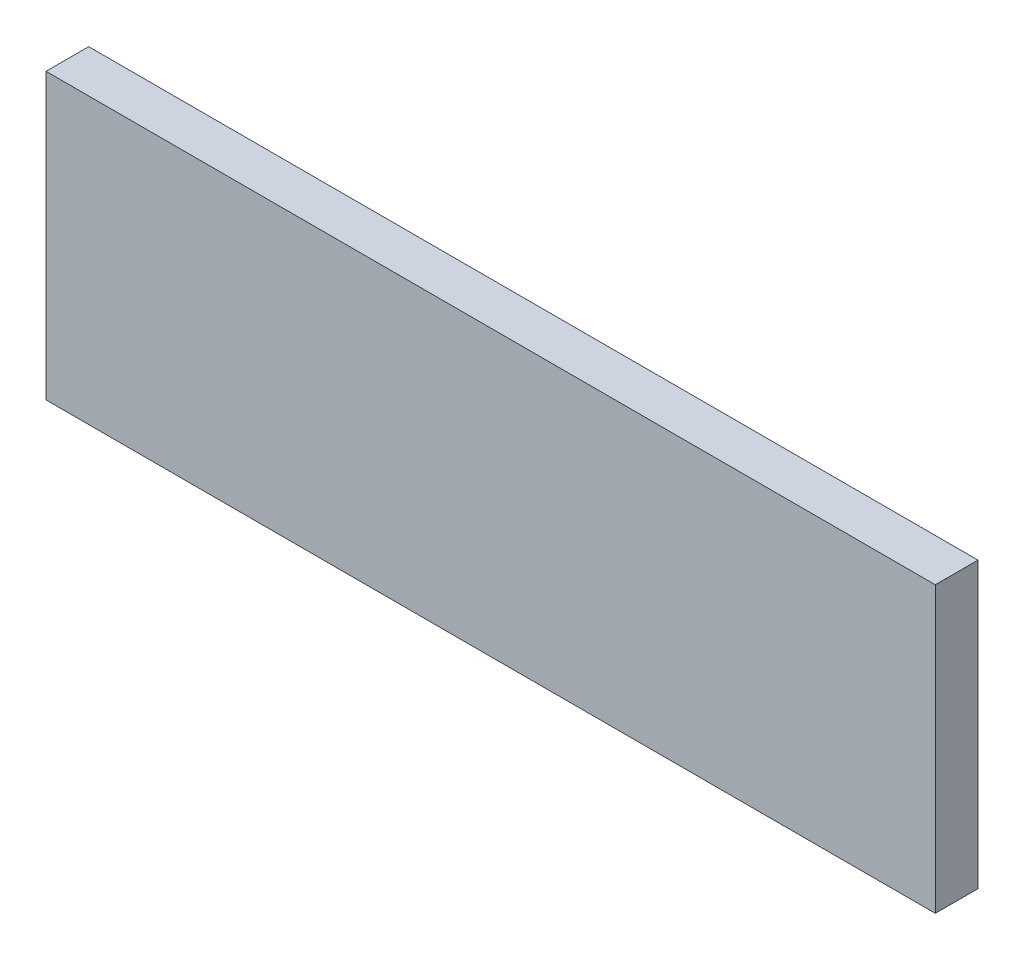
from build123d import *

# Parameters (mm, degrees)
CROQUIS1_W              = 25
CROQUIS1_H              = 8
SALIENTE_EXTRUIR1_DEPTH = 1.2


with BuildPart() as part:
    # Croquis1 → Saliente-Extruir1 (new body)
    with BuildSketch(Plane.XY):
        with Locations((-11.184210526, 1.951417004)):
            Rectangle(CROQUIS1_W, CROQUIS1_H)
    extrude(amount=SALIENTE_EXTRUIR1_DEPTH)


solid = part.part
